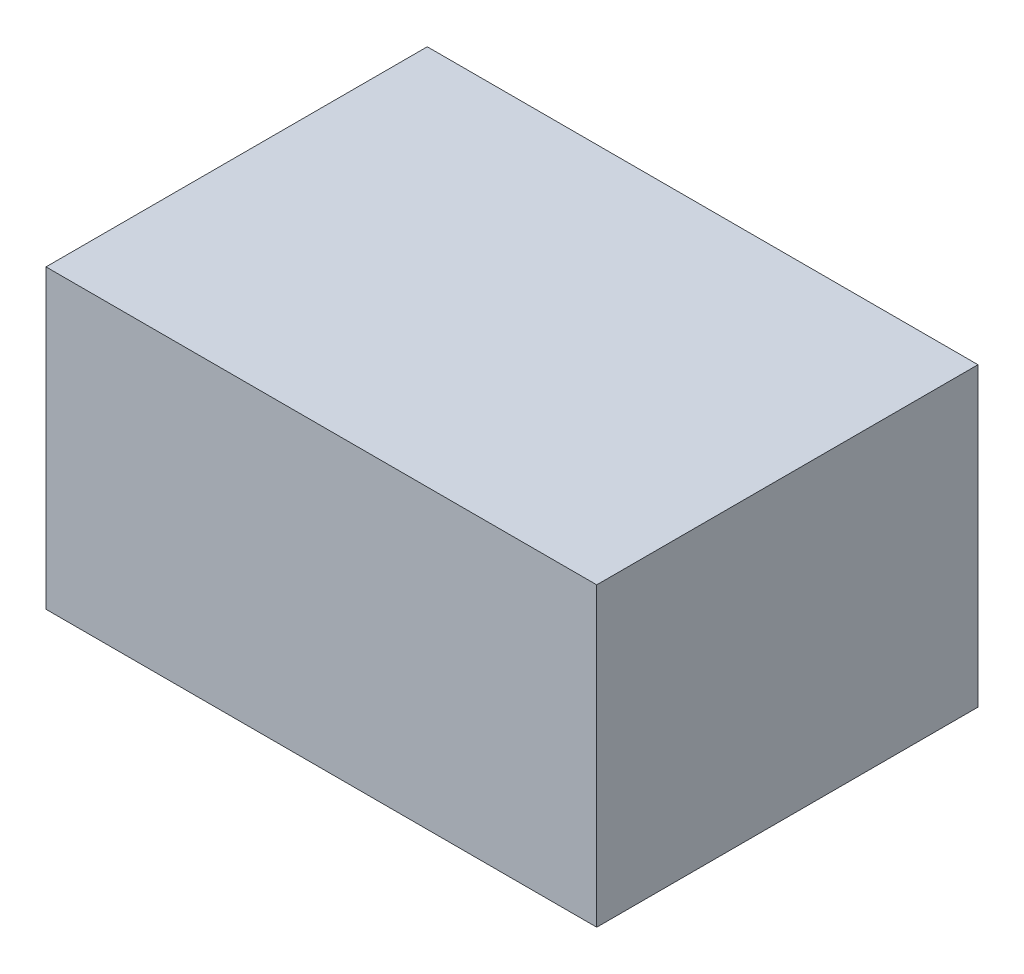
from build123d import *

# Parameters (mm, degrees)
SKETCH1_W           = 20.6375
SKETCH1_H           = 14.2875
BOSS_EXTRUDE1_DEPTH = 11.1125


with BuildPart() as part:
    # Sketch1 → Boss-Extrude1 (new body)
    with BuildSketch(Plane(origin=(0, 0, 0), x_dir=(1, 0, 0), z_dir=(0, 1, 0))):
        Rectangle(SKETCH1_W, SKETCH1_H)
    extrude(amount=BOSS_EXTRUDE1_DEPTH)


solid = part.part
